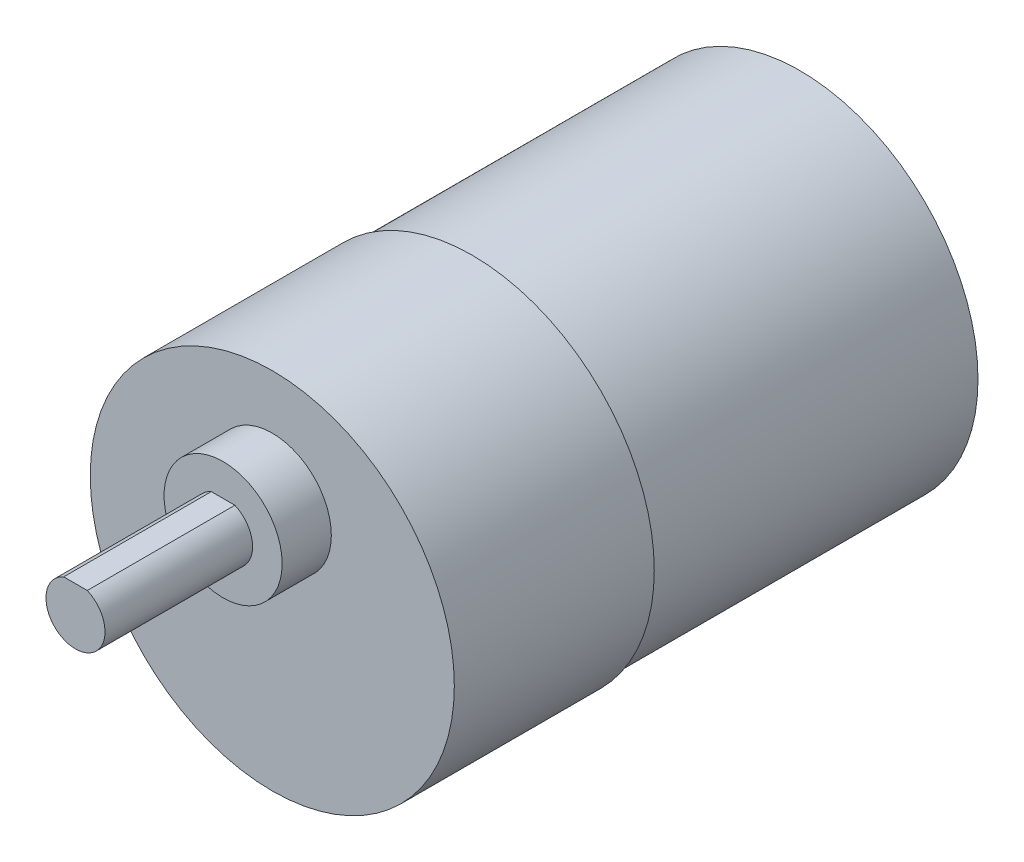
from build123d import *

# Parameters (mm, degrees)
SKETCH1_R           = 18.1
BOSS_EXTRUDE1_DEPTH = 16.65
SKETCH2_R           = 18.5
BOSS_EXTRUDE2_DEPTH = 20.32
SKETCH3_R           = 5.999999938
BOSS_EXTRUDE3_DEPTH = 5
SKETCH4_R           = 3
BOSS_EXTRUDE4_DEPTH = 15
SKETCH5_W           = 2.397915762
SKETCH5_H           = 1.769215018
CUT_EXTRUDE1_DEPTH  = 15


with BuildPart() as part:
    # Sketch1 → Boss-Extrude1 (new, symmetric)
    with BuildSketch(Plane.XY):
        Circle(SKETCH1_R)
    extrude(amount=BOSS_EXTRUDE1_DEPTH, both=True)

    # Sketch2 → Boss-Extrude2 (add)
    with BuildSketch(Plane.XY.offset(16.65)):
        Circle(SKETCH2_R)
    extrude(amount=BOSS_EXTRUDE2_DEPTH)

    # Sketch3 → Boss-Extrude3 (add)
    with BuildSketch(Plane.XY.offset(36.97)):
        with Locations((0, 7)):
            Circle(SKETCH3_R)
    extrude(amount=BOSS_EXTRUDE3_DEPTH)

    # Sketch4 → Boss-Extrude4 (add)
    with BuildSketch(Plane.XY.offset(41.97)):
        with Locations((0, 7)):
            Circle(SKETCH4_R)
    extrude(amount=BOSS_EXTRUDE4_DEPTH)

    # Sketch5 → Cut-Extrude1 (cut)
    with BuildSketch(Plane.XY.offset(56.97)):
        with Locations((0, 10.634607509)):
            Rectangle(SKETCH5_W, SKETCH5_H)
    extrude(amount=-CUT_EXTRUDE1_DEPTH, mode=Mode.SUBTRACT)


solid = part.part
